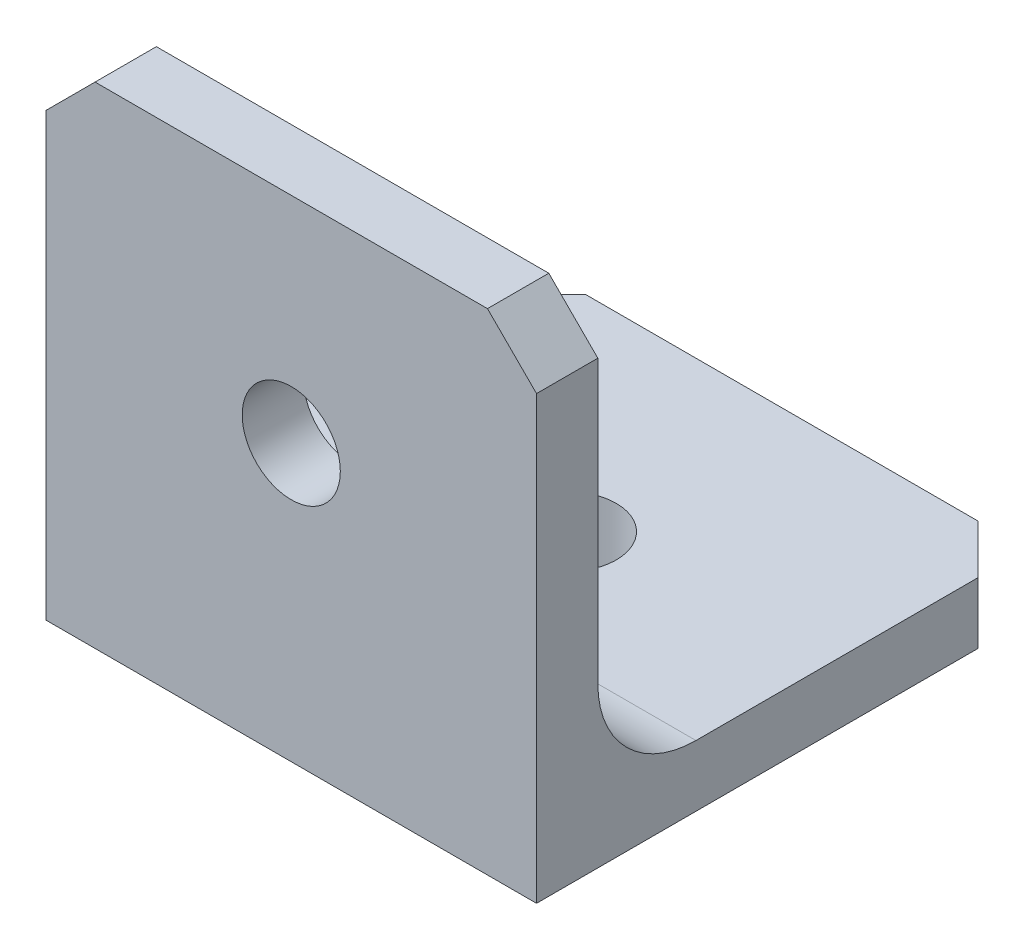
from build123d import *

# Parameters (mm, degrees)
BOSS_EXTRUDE1_DEPTH = 25.4
SKETCH2_R           = 2.54
CUT_EXTRUDE1_DEPTH  = 44.994090512
SKETCH3_R           = 2.54
CUT_EXTRUDE2_DEPTH  = 44.994090512
FILLET1_R           = 5.08
CHAMFER1_SIZE       = 2.54


with BuildPart() as part:
    # Sketch1 → Boss-Extrude1 (new body)
    with BuildSketch(Plane(origin=(0, 0, 0), x_dir=(0, 0, -1), z_dir=(1, 0, 0))):
        Polygon((0, 0), (0, 25.4), (3.175, 25.4), (3.175, 3.175), (25.4, 3.175), (25.4, 0), align=None)
    extrude(amount=BOSS_EXTRUDE1_DEPTH)

    # Sketch2 → Cut-Extrude1 (cut, through all)
    with BuildSketch(Plane.XY):
        with Locations((12.7, 14.2875)):
            Circle(SKETCH2_R)
    extrude(amount=-CUT_EXTRUDE1_DEPTH, mode=Mode.SUBTRACT)

    # Sketch3 → Cut-Extrude2 (cut, through all)
    with BuildSketch(Plane.XZ):
        with Locations(Location((12.7, -14.2875, 0), (0, 0, 270))):
            Circle(SKETCH3_R)
    extrude(amount=-CUT_EXTRUDE2_DEPTH, mode=Mode.SUBTRACT)

    # Fillet1
    fillet1_edges = [part.edges().sort_by_distance(p)[0] for p in [
        (12.7, 3.175, -3.175),
    ]]
    fillet(fillet1_edges, radius=FILLET1_R)

    # Chamfer1
    chamfer1_edges = [part.edges().sort_by_distance(p)[0] for p in [
        (25.4, 25.4, -1.5875),
        (0, 25.4, -1.5875),
        (0, 1.5875, -25.4),
        (25.4, 1.5875, -25.4),
    ]]
    chamfer(chamfer1_edges, length=CHAMFER1_SIZE)


solid = part.part
